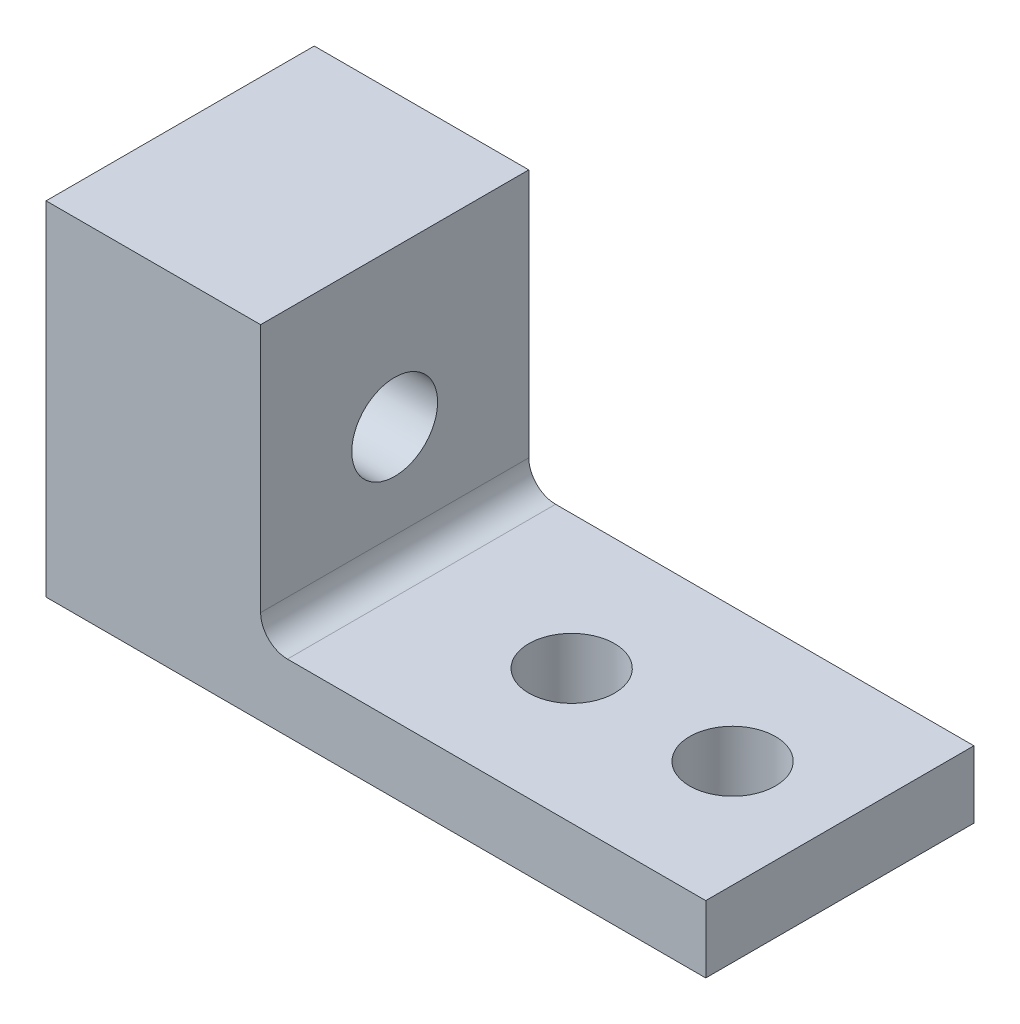
from build123d import *

# Parameters (mm, degrees)
BOSS_EXTRUDE1_DEPTH = 6.35
CUT_EXTRUDE1_REACH  = 37.786
SKETCH2_R           = 2.032
CUT_EXTRUDE2_REACH  = 37.786
SKETCH3_R           = 2.032
FILLET2_R           = 1.27
LPATTERN1_COUNT     = 2
LPATTERN1_PITCH     = 7.62


with BuildPart() as part:
    # Sketch1 → Boss-Extrude1 (new, symmetric)
    with BuildSketch(Plane.XY):
        Polygon((0, 0), (0, 16.256), (10.16, 16.256), (10.16, 3.175), (31.242, 3.175), (31.242, 0), align=None)
    extrude(amount=BOSS_EXTRUDE1_DEPTH, both=True)

    # Sketch2 → Cut-Extrude1 (cut, up to next)
    with BuildSketch(Plane.ZY, mode=Mode.PRIVATE) as cut_extrude1_sk1:
        with Locations((0, 8.89)):
            Circle(SKETCH2_R)
    cut_extrude1_tool1 = extrude(cut_extrude1_sk1.sketch, amount=-CUT_EXTRUDE1_REACH, mode=Mode.PRIVATE) & part.part
    add(cut_extrude1_tool1.solids().sort_by_distance((0, 8.89, 0))[0], mode=Mode.SUBTRACT)

    # Sketch3 → Cut-Extrude2 (cut, up to next)
    with BuildSketch(Plane.XZ, mode=Mode.PRIVATE) as cut_extrude2_sk1:
        with Locations((18.542, 0)):
            Circle(SKETCH3_R)
    cut_extrude2_tool1 = extrude(cut_extrude2_sk1.sketch, amount=-CUT_EXTRUDE2_REACH, mode=Mode.PRIVATE) & part.part
    cut_extrude2 = cut_extrude2_tool1.solids().sort_by_distance((18.542, 0, 0))[0]
    add(cut_extrude2, mode=Mode.SUBTRACT)

    # Fillet2
    fillet2_edges = [part.edges().sort_by_distance(p)[0] for p in [
        (10.16, 3.175, 0),
    ]]
    fillet(fillet2_edges, radius=FILLET2_R)

    # LPattern1: Cut-Extrude2 ×2
    with Locations(*[(i * LPATTERN1_PITCH, 0, 0) for i in range(1, LPATTERN1_COUNT)]):
        add(cut_extrude2, mode=Mode.SUBTRACT)


solid = part.part
